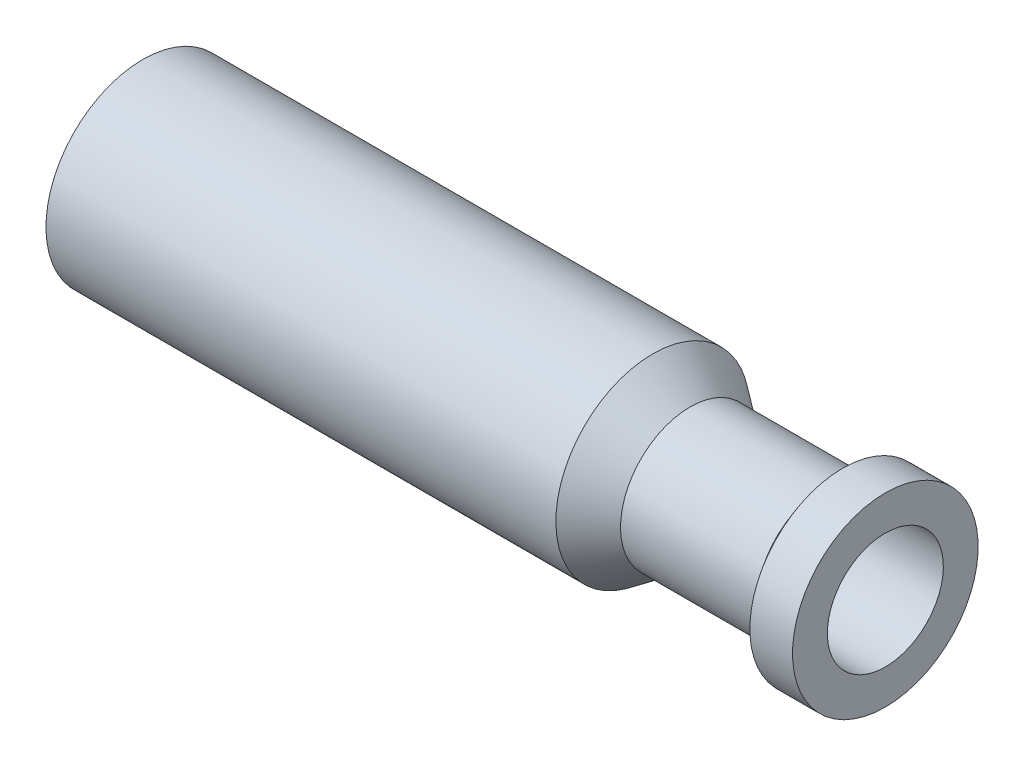
from build123d import *

# Parameters (mm, degrees)
SKETCH4_R          = 15.875
CUT_EXTRUDE1_DEPTH = 190.5


with BuildPart() as part:
    # Sketch1 → Revolve1 (revolve)
    with BuildSketch(Plane.XY):
        Polygon((107.503032851, -15.910925594), (117.715228697, -23.386149331), (154.81866926, -23.386149331), (159.466804827, -17.036149331), (171.145497316, -17.036149331), (171.145497316, -42.436149331), (-32.054502684, -42.436149331), (-32.054502684, -15.910925594), align=None)
    revolve(axis=Axis((171.145497316, -42.436149331, 0), (-1, 0, 0)))

    # Sketch4 → Cut-Extrude1 (cut)
    with BuildSketch(Plane(origin=(171.145497316, 0, 0), x_dir=(0, 0, -1), z_dir=(1, 0, 0))):
        with Locations(Location((0, -42.436149331, 0), (0, 0, 90))):
            Circle(SKETCH4_R)
    extrude(amount=-CUT_EXTRUDE1_DEPTH, mode=Mode.SUBTRACT)


solid = part.part
